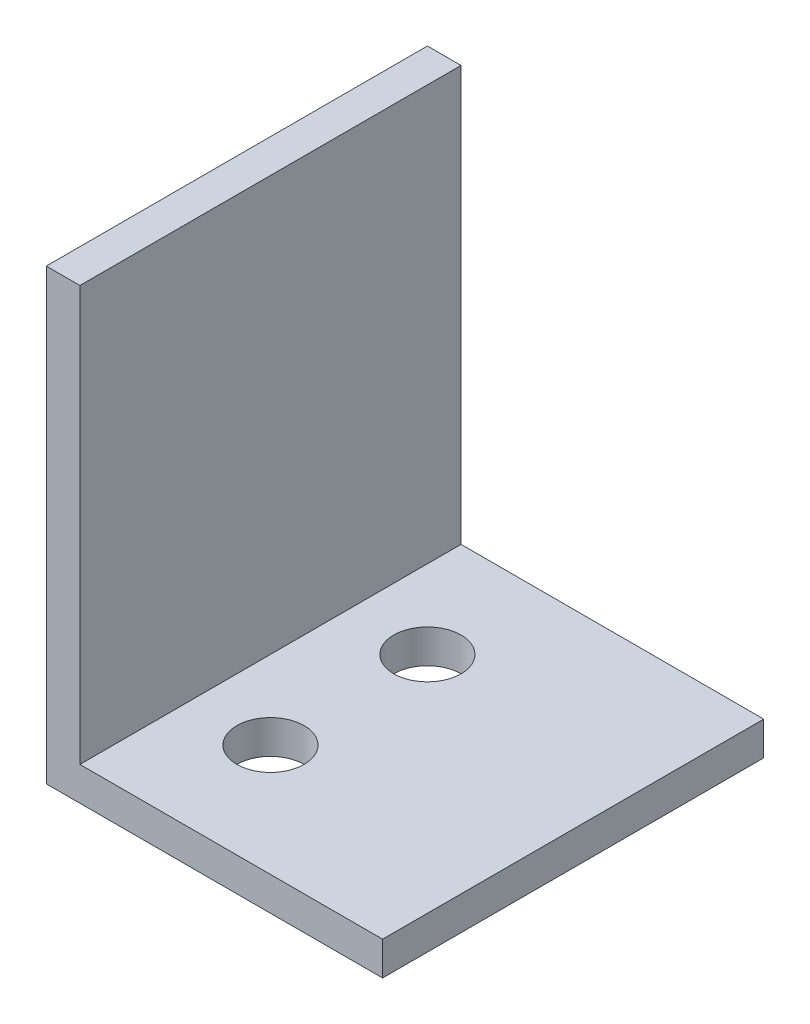
from build123d import *

# Parameters (mm, degrees)
EXTRUSION1_DEPTH = 17
ESQUISSE2_R      = 1.5
EXTRUSION2_DEPTH = 10


with BuildPart() as part:
    # Esquisse1 → Extrusion1 (new body)
    with BuildSketch(Plane.XY):
        Polygon((-23.113265327, 4.318842105), (-23.113265327, -15.681157895), (-8.113265327, -15.681157895), (-8.113265327, -14.181157895), (-21.613265327, -14.181157895), (-21.613265327, 4.318842105), align=None)
    extrude(amount=EXTRUSION1_DEPTH)

    # Esquisse2 → Extrusion2 (cut)
    with BuildSketch(Plane(origin=(0, -14.181157895, 0), x_dir=(-1, 0, 0), z_dir=(0, 1, 0))):
        with Locations((18.113265327, 12)):
            Circle(ESQUISSE2_R)
        with Locations((18.113265327, 5)):
            Circle(ESQUISSE2_R)
    extrude(amount=-EXTRUSION2_DEPTH, mode=Mode.SUBTRACT)


solid = part.part
